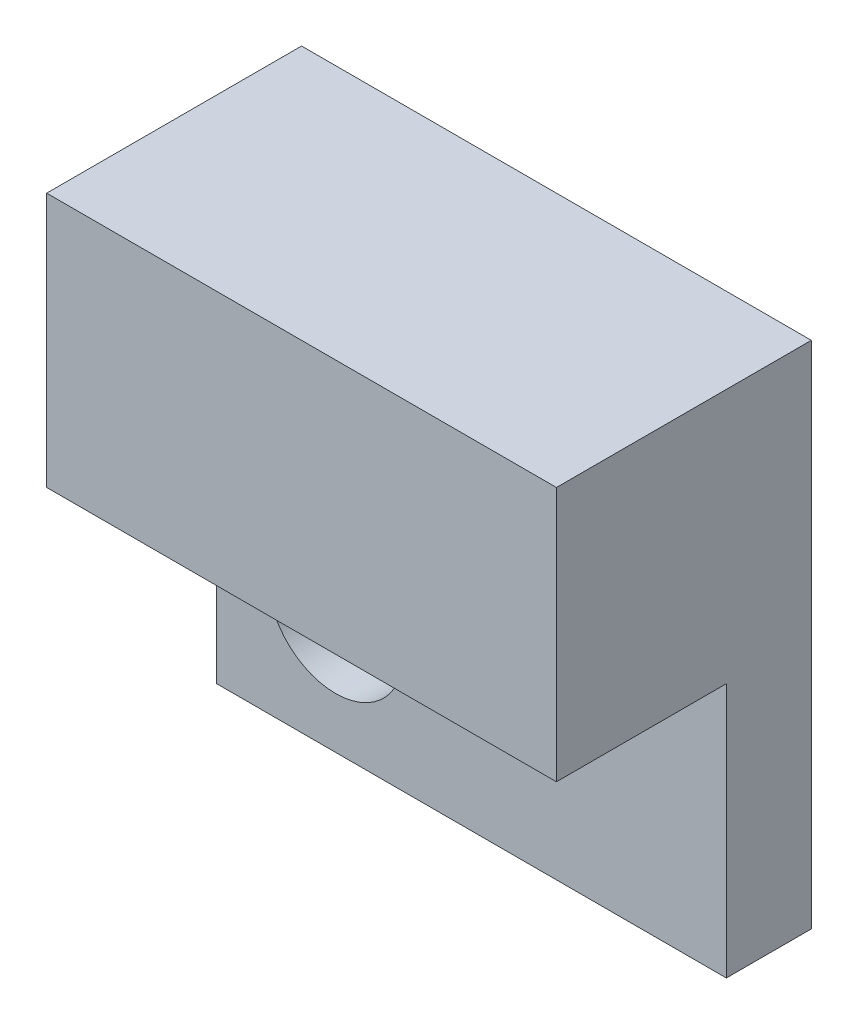
from build123d import *

# Parameters (mm, degrees)
SKETCH_1_W          = 30
SKETCH_1_H          = 30
EXTRUDE_1_DEPTH     = 15
SKETCH_2_R          = 4
CUT_EXTRUDE_1_DEPTH = 46
SKETCH_3_W          = 10
SKETCH_3_H          = 15
CUT_EXTRUDE_2_DEPTH = 46


with BuildPart() as part:
    # 草图1 → 凸台-拉伸1 (new body)
    with BuildSketch(Plane.XY):
        with Locations((15, 15)):
            Rectangle(SKETCH_1_W, SKETCH_1_H)
    extrude(amount=EXTRUDE_1_DEPTH)

    # 草图2 → 切除-拉伸1 (cut, through all)
    with BuildSketch(Plane.XY.offset(15)):
        with Locations((7, 7)):
            Circle(SKETCH_2_R)
    extrude(amount=-CUT_EXTRUDE_1_DEPTH, mode=Mode.SUBTRACT)

    # 草图3 → 切除-拉伸2 (cut, through all)
    with BuildSketch(Plane.ZY):
        with Locations((10, 7.5)):
            Rectangle(SKETCH_3_W, SKETCH_3_H)
    extrude(amount=-CUT_EXTRUDE_2_DEPTH, mode=Mode.SUBTRACT)


solid = part.part
